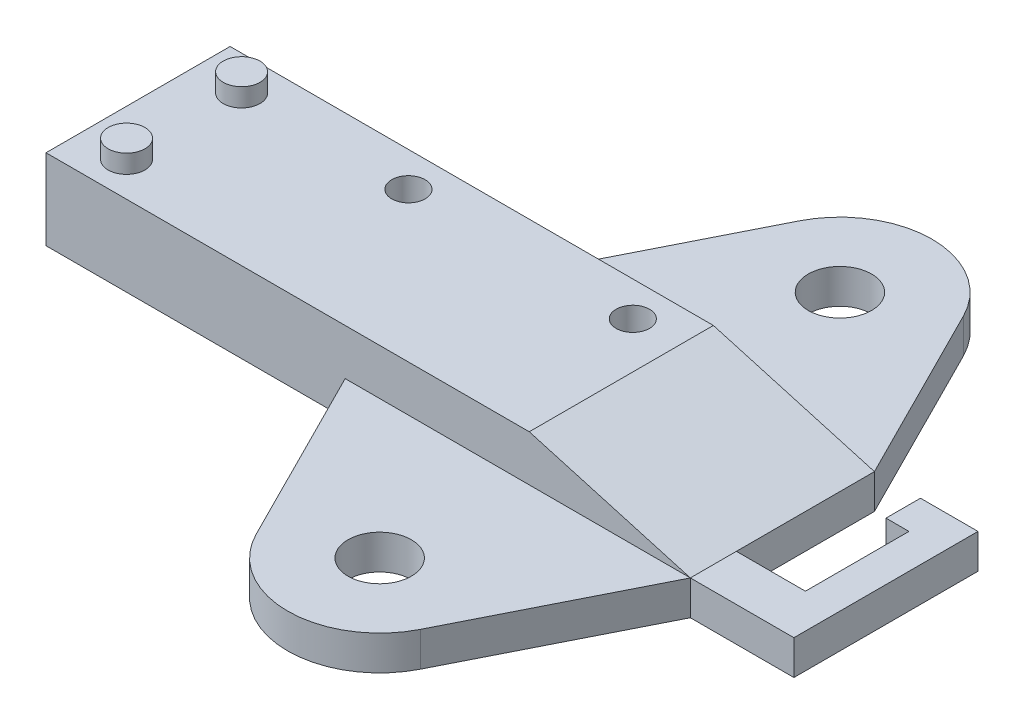
from build123d import *

# Parameters (mm, degrees)
SKETCH1_W           = 42
SKETCH1_H           = 16
BOSS_EXTRUDE1_DEPTH = 7
SKETCH2_R           = 1.6
BOSS_EXTRUDE2_DEPTH = 1.6
CUT_EXTRUDE1_REACH  = 26.062
SKETCH3_R           = 1.45
SKETCH4_R           = 2.75
BOSS_EXTRUDE3_DEPTH = 3
BOSS_EXTRUDE4_DEPTH = 8
BOSS_EXTRUDE5_DEPTH = 3


with BuildPart() as part:
    # Sketch1 → Boss-Extrude1 (new body)
    with BuildSketch(Plane(origin=(0, 0, 0), x_dir=(1, 0, 0), z_dir=(0, 1, 0))):
        Rectangle(SKETCH1_W, SKETCH1_H)
    extrude(amount=BOSS_EXTRUDE1_DEPTH)

    # Sketch2 → Boss-Extrude2 (add)
    with BuildSketch(Plane(origin=(0, 7, 0), x_dir=(1, 0, 0), z_dir=(0, 1, 0))):
        with Locations(Location((-17, 5, 0), (0, 0, 270))):
            Circle(SKETCH2_R)
        with Locations(Location((-17, -5, 0), (0, 0, 270))):
            Circle(SKETCH2_R)
    extrude(amount=BOSS_EXTRUDE2_DEPTH)

    # Sketch3 → Cut-Extrude1 (cut, up to next)
    with BuildSketch(Plane(origin=(0, 0, 0), x_dir=(1, 0, 0), z_dir=(0, 1, 0)), mode=Mode.PRIVATE) as cut_extrude1_sk1:
        with Locations(Location((-2.5, 5, 0), (0, 0, 270))):
            Circle(SKETCH3_R)
    cut_extrude1_tool1 = extrude(cut_extrude1_sk1.sketch, amount=CUT_EXTRUDE1_REACH, mode=Mode.PRIVATE) & part.part
    # Sketch3 → Cut-Extrude1 (cut, up to next)
    with BuildSketch(Plane(origin=(0, 0, 0), x_dir=(1, 0, 0), z_dir=(0, 1, 0)), mode=Mode.PRIVATE) as cut_extrude1_sk2:
        with Locations(Location((17, 5, 0), (0, 0, 270))):
            Circle(SKETCH3_R)
    cut_extrude1_tool2 = extrude(cut_extrude1_sk2.sketch, amount=CUT_EXTRUDE1_REACH, mode=Mode.PRIVATE) & part.part
    add(cut_extrude1_tool1.solids().sort_by_distance((-2.5, 0, -5))[0], mode=Mode.SUBTRACT)
    add(cut_extrude1_tool2.solids().sort_by_distance((17, 0, -5))[0], mode=Mode.SUBTRACT)

    # Sketch4 → Boss-Extrude3 (add)
    # profile 1 of 2: a face of its own
    with BuildSketch(Plane(origin=(0, 0, 0), x_dir=(1, 0, 0), z_dir=(0, 1, 0))):
        with BuildLine():
            Line((12.854829477, 23.59812982), (5, 8))
            Line((5, 8), (35, 8))
            Line((35, 8), (27.145170523, 23.59812982))
            ThreePointArc((27.145170523, 23.59812982), (20, 28), (12.854829477, 23.59812982))
        make_face()
        with Locations(Location((20, 20, 0), (0, 0, 270))):
            Circle(SKETCH4_R, mode=Mode.SUBTRACT)
    # profile 2 of 2: a face of its own
    with BuildSketch(Plane(origin=(0, 0, 0), x_dir=(1, 0, 0), z_dir=(0, 1, 0))):
        with BuildLine():
            Line((35, -8), (27.145170523, -23.59812982))
            ThreePointArc((27.145170523, -23.59812982), (20, -28), (12.854829477, -23.59812982))
            Line((12.854829477, -23.59812982), (5, -8))
            Line((5, -8), (35, -8))
        make_face()
        with Locations(Location((20, -20, 0), (0, 0, 90))):
            Circle(SKETCH4_R, mode=Mode.SUBTRACT)
    extrude(amount=BOSS_EXTRUDE3_DEPTH)

    # Sketch5 → Boss-Extrude4 (add, symmetric)
    with BuildSketch(Plane.XY):
        Polygon((21, 7), (35, 3), (35, 0), (21, 0), align=None)
    extrude(amount=BOSS_EXTRUDE4_DEPTH, both=True)

    # Sketch6 → Boss-Extrude5 (add)
    with BuildSketch(Plane(origin=(0, 0, 0), x_dir=(1, 0, 0), z_dir=(0, 1, 0))):
        Polygon((35, -8), (44, -8), (44, 8), (39, 8), (39, 5), (41, 5), (41, -4), (35, -4), align=None)
    extrude(amount=BOSS_EXTRUDE5_DEPTH)


solid = part.part
